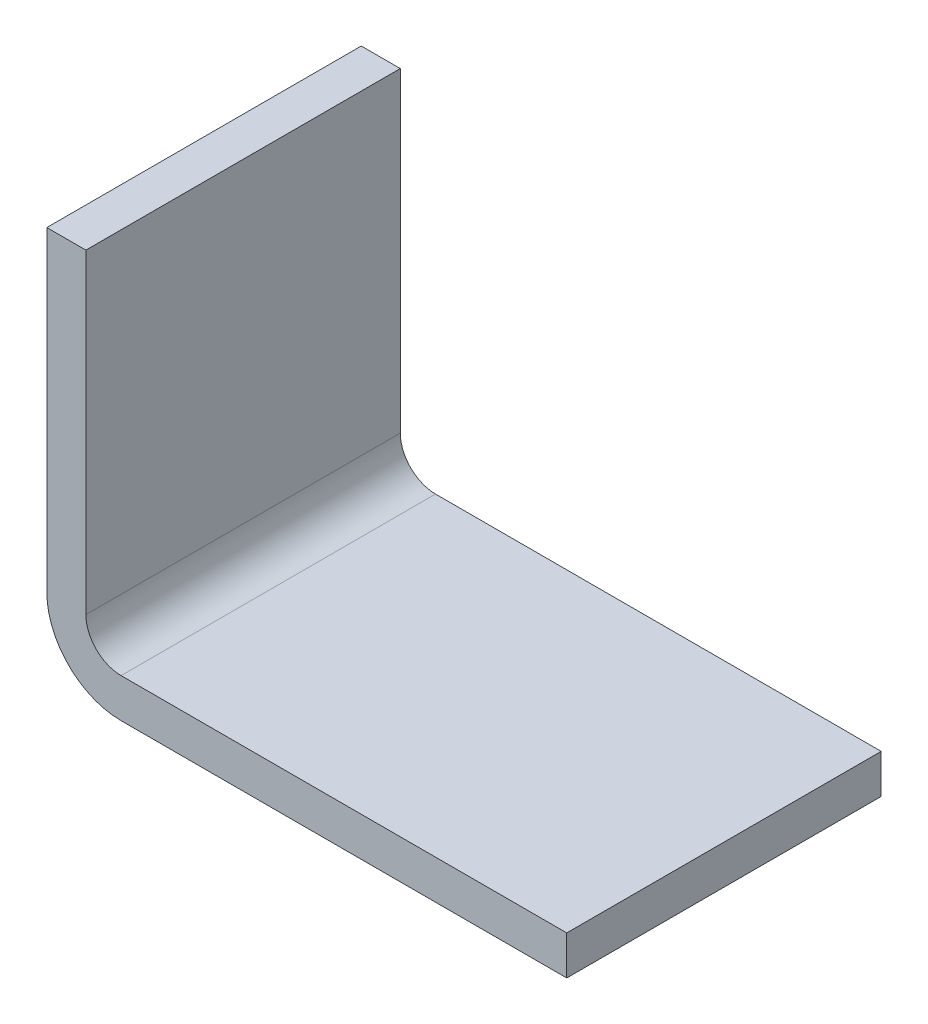
from build123d import *

# Parameters (mm, degrees)
SALIENTE_EXTRUIR3_DEPTH = 50.8


with BuildPart() as part:
    # Croquis13 → Saliente-Extruir3 (new body)
    with BuildSketch(Plane.XY):
        with BuildLine():
            Line((0, 0), (-72, 0))
            ThreePointArc((-72, 0), (-80.485281374, 3.514718626), (-84, 12))
            Line((-84, 12), (-84, 63))
            Line((-84, 63), (-77.69, 63))
            Line((-77.69, 63), (-77.69, 12))
            ThreePointArc((-77.69, 12), (-76.023437585, 7.976562415), (-72, 6.31))
            Line((-72, 6.31), (0, 6.31))
            Line((0, 6.31), (0, 0))
        make_face()
    extrude(amount=SALIENTE_EXTRUIR3_DEPTH)


solid = part.part
